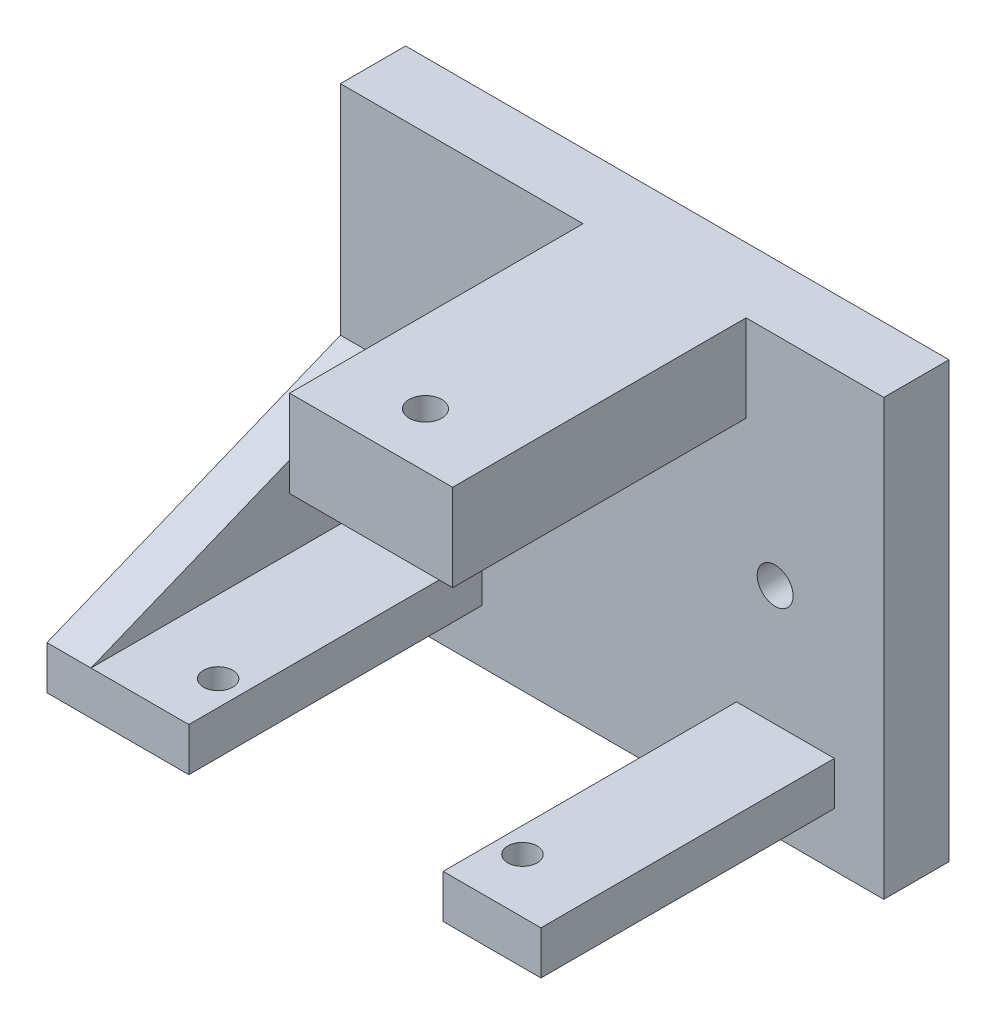
from build123d import *

# Parameters (mm, degrees)
SKETCH_1_W          = 50
SKETCH_1_H          = 40
SKETCH_1_R          = 1.65
EXTRUDE_1_DEPTH     = 6
SKETCH_4_W          = 9
SKETCH_4_H          = 4
EXTRUDE_2_DEPTH     = 27
SKETCH_5_R          = 1.35
CUT_EXTRUDE_1_DEPTH = 10
EXTRUDE_3_DEPTH     = 4.05
SKETCH_8_W          = 15
SKETCH_8_H          = 27
SKETCH_8_R          = 1.5
EXTRUDE_5_DEPTH     = 8


with BuildPart() as part:
    # 草图1 → 凸台-拉伸1 (new body)
    with BuildSketch(Plane.XY):
        with Locations((234.126074566, 0)):
            Rectangle(SKETCH_1_W, SKETCH_1_H)
        with Locations((219.126074566, 0)):
            Circle(SKETCH_1_R, mode=Mode.SUBTRACT)
        with Locations((249.126074566, 0)):
            Circle(SKETCH_1_R, mode=Mode.SUBTRACT)
    extrude(amount=EXTRUDE_1_DEPTH)

    # 草图4 → 凸台-拉伸2 (add)
    with BuildSketch(Plane.XY.offset(6)):
        with Locations((217.676074566, -13.041642787)):
            Rectangle(SKETCH_4_W, SKETCH_4_H)
        with Locations((250.076074566, -13.041642787)):
            Rectangle(SKETCH_4_W, SKETCH_4_H)
    extrude(amount=EXTRUDE_2_DEPTH)

    # 草图5 → 切除-拉伸1 (cut)
    with BuildSketch(Plane.XZ.offset(15.041642787)):
        with Locations((247.876074566, 28)):
            Circle(SKETCH_5_R)
        with Locations(Location((219.876074566, 28, 0), (0, 0, 270))):
            Circle(SKETCH_5_R)
    extrude(amount=-CUT_EXTRUDE_1_DEPTH, mode=Mode.SUBTRACT)

    # 草图6 → 凸台-拉伸3 (add)
    with BuildSketch(Plane.ZY.offset(-213.176074566)):
        Polygon((6, -15.041642787), (6, -0.041642787), (33, -11.041642787), (33, -15.041642787), align=None)
    extrude(amount=EXTRUDE_3_DEPTH)

    # 草图8 → 凸台-拉伸5 (add)
    with BuildSketch(Plane(origin=(0, 20, 0), x_dir=(1, 0, 0), z_dir=(0, 1, 0))):
        with Locations((238.951074566, -19.5)):
            Rectangle(SKETCH_8_W, SKETCH_8_H)
        with Locations(Location((238.951074566, -28, 0), (0, 0, 270))):
            Circle(SKETCH_8_R, mode=Mode.SUBTRACT)
    extrude(amount=-EXTRUDE_5_DEPTH)


solid = part.part
